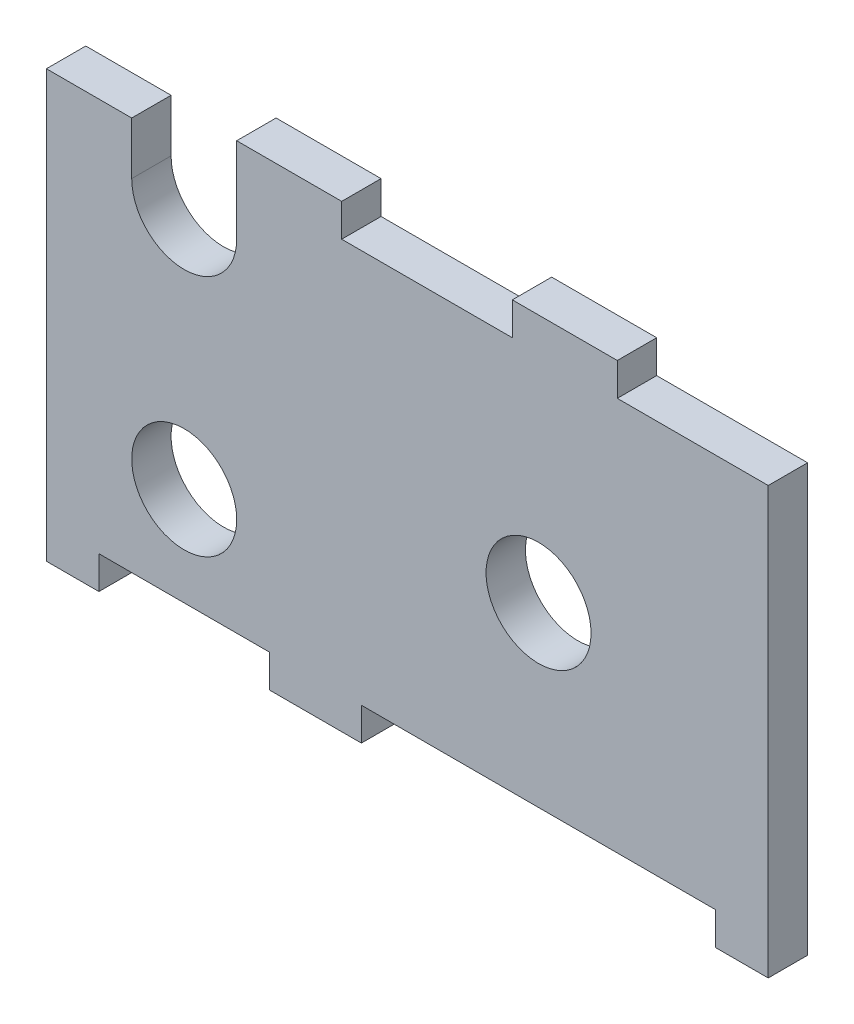
from build123d import *

# Parameters (mm, degrees)
ESQUISSE1_R        = 4
BOSS_EXTRU_1_DEPTH = 3


with BuildPart() as part:
    # Esquisse1 → Boss.-Extru.1 (new body)
    with BuildSketch(Plane.XY):
        with BuildLine():
            Line((-21, 15), (-27.5, 15))
            Line((-27.5, 15), (-27.5, -17.5))
            Line((-27.5, -17.5), (-23.5, -17.5))
            Line((-23.5, -17.5), (-23.5, -15))
            Line((-23.5, -15), (-10.5, -15))
            Line((-10.5, -15), (-10.5, -17.5))
            Line((-10.5, -17.5), (-3.5, -17.5))
            Line((-3.5, -17.5), (-3.5, -15))
            Line((-3.5, -15), (23.5, -15))
            Line((23.5, -15), (23.5, -17.5))
            Line((23.5, -17.5), (27.5, -17.5))
            Line((27.5, -17.5), (27.5, 15))
            Line((27.5, 15), (16, 15))
            Line((16, 15), (16, 17.5))
            Line((16, 17.5), (8, 17.5))
            Line((8, 17.5), (8, 15))
            Line((8, 15), (-5, 15))
            Line((-5, 15), (-5, 17.5))
            Line((-5, 17.5), (-13, 17.5))
            Line((-13, 17.5), (-13, 11))
            ThreePointArc((-13, 11), (-17, 7), (-21, 11))
            Line((-21, 11), (-21, 15))
        make_face()
        with Locations((10, -1.5)):
            Circle(ESQUISSE1_R, mode=Mode.SUBTRACT)
        with Locations((-17, -7.5)):
            Circle(ESQUISSE1_R, mode=Mode.SUBTRACT)
    extrude(amount=BOSS_EXTRU_1_DEPTH)


solid = part.part
